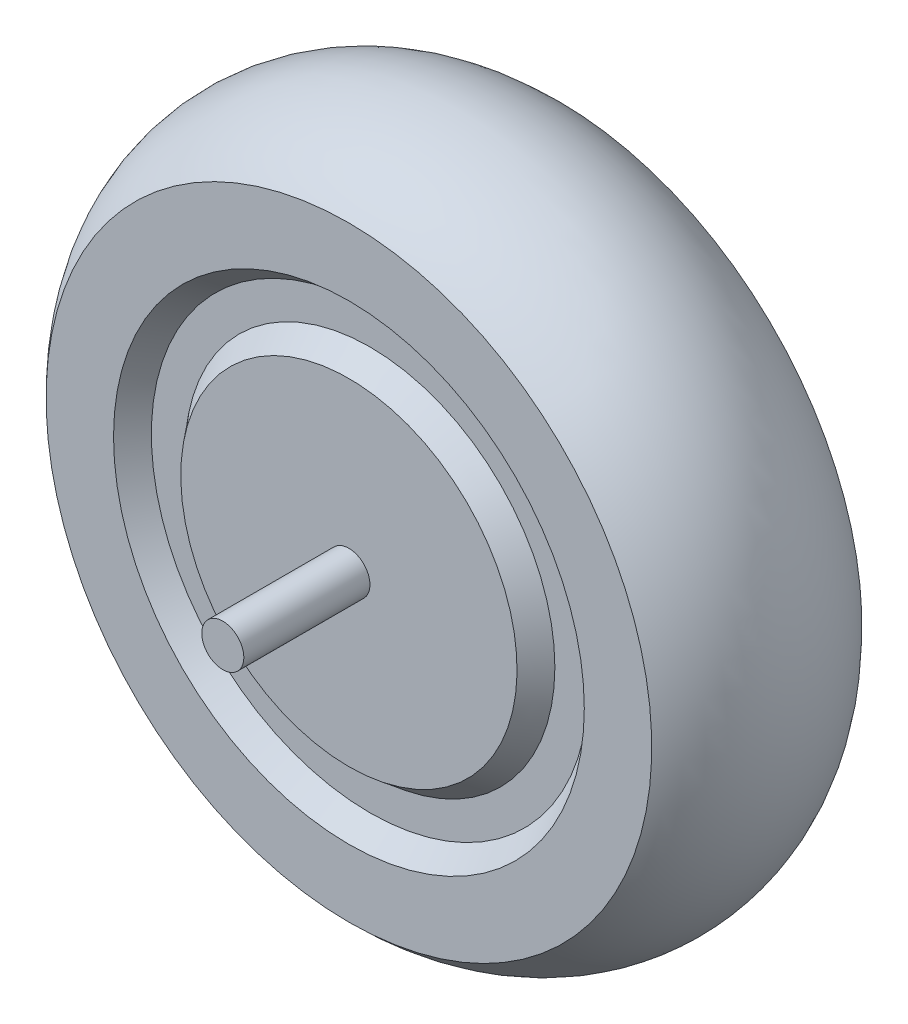
from build123d import *


with BuildPart() as part:
    # Croquis1 → Revolución1 (revolve)
    with BuildSketch(Plane(origin=(0, 0, 0), x_dir=(0, 0, -1), z_dir=(1, 0, 0))):
        with BuildLine():
            Line((-40, 0), (40, 0))
            Line((40, 0), (40, -40))
            Line((40, -40), (35, -44))
            Line((35, -44), (35, -52))
            Line((35, -52), (40, -56))
            Line((40, -56), (40, -72.044897428))
            ThreePointArc((40, -72.044897428), (15, -82.55), (-10, -72.044897428))
            Line((-10, -72.044897428), (-10, -56))
            Line((-10, -56), (-5, -52))
            Line((-5, -52), (-5, -44))
            Line((-5, -44), (-10, -40))
            Line((-10, -40), (-10, -5))
            Line((-10, -5), (-40, -5))
            Line((-40, -5), (-40, 0))
        make_face()
    revolve(axis=Axis((0, 0, 40), (0, 0, -1)))


solid = part.part
